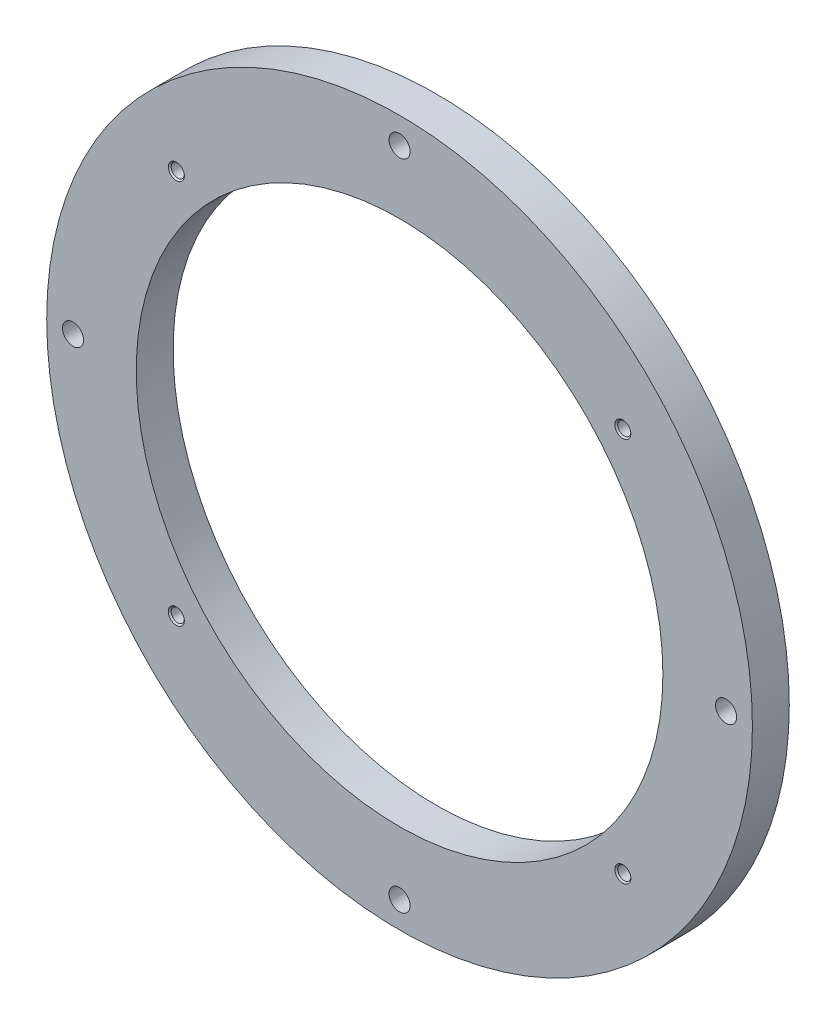
from build123d import *

# Parameters (mm, degrees)
SCHIZZO2_R                      = 67
ESTRUSIONE_ESTRUSIONE1_DEPTH    = 7
SCHIZZO3_R                      = 2
TAGLIO_ESTRUSIONE2_DEPTH        = 7
RIPETIZIONECIRCOLARE1_COUNT     = 4
FORO_FILETTATO_M3_1_D           = 2.5
FORO_FILETTATO_M3_1_CSINK_D     = 3.05
FORO_FILETTATO_M3_1_CSINK_ANGLE = 90
SCHIZZO4_R                      = 50
TAGLIO_ESTRUSIONE3_DEPTH        = 7


with BuildPart() as part:
    # Schizzo2 → Estrusione-Estrusione1 (new body)
    with BuildSketch(Plane.XY):
        Circle(SCHIZZO2_R)
    extrude(amount=ESTRUSIONE_ESTRUSIONE1_DEPTH)

    # Schizzo3 → Taglio-Estrusione2 (cut)
    with BuildSketch(Plane.XY):
        with Locations(Location((0, 62, 0), (0, 0, 180))):
            Circle(SCHIZZO3_R)
    taglio_estrusione2 = extrude(amount=TAGLIO_ESTRUSIONE2_DEPTH, mode=Mode.SUBTRACT)

    # RipetizioneCircolare1: Taglio-Estrusione2 ×4 about axis
    ripetizionecircolare1_axis = Axis((0, 0, 0), (0, 0, 1))
    for i in range(1, RIPETIZIONECIRCOLARE1_COUNT):
        add(taglio_estrusione2.rotate(ripetizionecircolare1_axis, i * 360 / RIPETIZIONECIRCOLARE1_COUNT), mode=Mode.SUBTRACT)

    # Foro filettato M3-1 (through all)
    with Locations(Plane(origin=(-42.39, -36.56, 7), x_dir=(1, 0, 0), z_dir=(0, 0, 1))):
        with Locations((0, 0), (84.78, 0), (84.78, 73.12), (0, 73.12)):
            CounterSinkHole(FORO_FILETTATO_M3_1_D / 2, FORO_FILETTATO_M3_1_CSINK_D / 2, counter_sink_angle=FORO_FILETTATO_M3_1_CSINK_ANGLE)

    # Schizzo4 → Taglio-Estrusione3 (cut)
    with BuildSketch(Plane.XY.offset(7)):
        Circle(SCHIZZO4_R)
    extrude(amount=-TAGLIO_ESTRUSIONE3_DEPTH, mode=Mode.SUBTRACT)


solid = part.part
